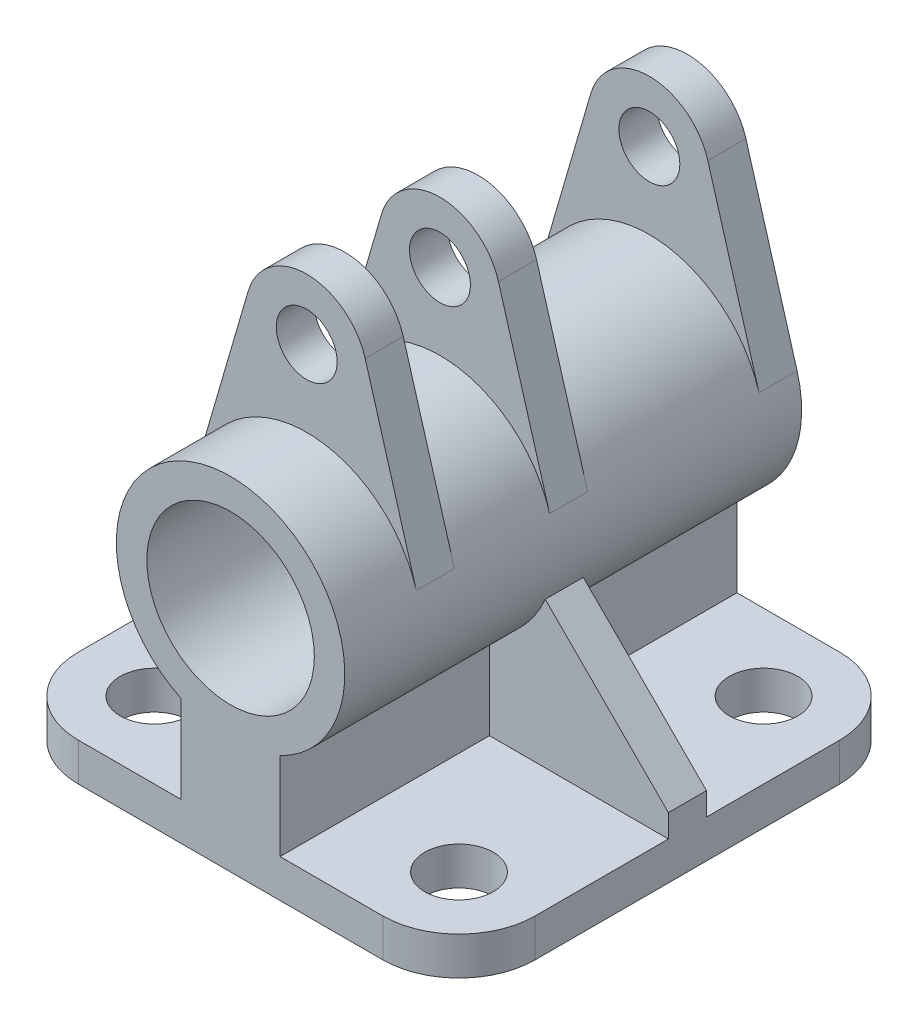
from build123d import *

# Parameters (mm, degrees)
SKETCH_1_R               = 15
SKETCH_1_R_2             = 11
EXTRUDE_1_DEPTH          = 30
SKETCH_1_3_R             = 4
EXTRUDE_2_DEPTH          = 2.5
EXTRUDE_START            = 20
SKETCH_1_6_R             = 4
EXTRUDE_3_DEPTH          = 5
EXTRUDE_START_2          = -25
SKETCH_1_7_R             = 4
EXTRUDE_4_DEPTH          = 5
SKETCH_2_R               = 4.5
CUT_EXTRUDE_1_DEPTH      = 72.860976893
MIRROR_2_COPY_1_SKETCH_R = 4.5
MIRROR_2_COPY_1_DEPTH    = 72.860976893
FILLET_1_R               = 10


with BuildPart() as part:
    # Эскиз1 → Бобышка-Вытянуть1 (new, symmetric)
    # profile 1 of 2: a face of its own
    with BuildSketch(Plane.XY):
        with BuildLine():
            Line((6.5, -25), (6.5, -13.518505835))
            ThreePointArc((6.5, -13.518505835), (0, -15), (-6.5, -13.518505835))
            Line((-6.5, -13.518505835), (-6.5, -25))
            Line((-6.5, -25), (-30, -25))
            Line((-30, -25), (-30, -30))
            Line((-30, -30), (30, -30))
            Line((30, -30), (30, -25))
            Line((30, -25), (6.5, -25))
        make_face()
    # profile 2 of 2: a face of its own
    with BuildSketch(Plane.XY):
        Circle(SKETCH_1_R)
        Circle(SKETCH_1_R_2, mode=Mode.SUBTRACT)
    extrude(amount=EXTRUDE_1_DEPTH, both=True)

    # Эскиз1<3> → Бобышка-Вытянуть2 (add, symmetric)
    # profile 1 of 3: a face of its own
    with BuildSketch(Plane.XY):
        with BuildLine():
            ThreePointArc((-14.4, 4.2), (0, 15), (14.4, 4.2))
            Line((14.4, 4.2), (7.68, 27.24))
            ThreePointArc((7.68, 27.24), (0, 33), (-7.68, 27.24))
            Line((-7.68, 27.24), (-14.4, 4.2))
        make_face()
        with Locations((0, 25)):
            Circle(SKETCH_1_3_R, mode=Mode.SUBTRACT)
    # profile 2 of 3: a face of its own
    with BuildSketch(Plane.XY):
        with BuildLine():
            Line((30, -22), (13.823441352, -5.823441352))
            ThreePointArc((13.823441352, -5.823441352), (10.865729218, -10.340982959), (6.5, -13.518505835))
            Line((6.5, -13.518505835), (6.5, -25))
            Line((6.5, -25), (30, -25))
            Line((30, -25), (30, -22))
        make_face()
    # profile 3 of 3: a face of its own
    with BuildSketch(Plane.XY):
        with BuildLine():
            Line((-6.5, -25), (-6.5, -13.518505835))
            ThreePointArc((-6.5, -13.518505835), (-10.865729218, -10.340982959), (-13.823441352, -5.823441352))
            Line((-13.823441352, -5.823441352), (-30, -22))
            Line((-30, -22), (-30, -25))
            Line((-30, -25), (-6.5, -25))
        make_face()
    extrude(amount=EXTRUDE_2_DEPTH, both=True)

    # Эскиз1<6> → Бобышка-Вытянуть3 (add)
    with BuildSketch(Plane.XY.offset(EXTRUDE_START)):
        with BuildLine():
            ThreePointArc((-14.4, 4.2), (0, 15), (14.4, 4.2))
            Line((14.4, 4.2), (7.68, 27.24))
            ThreePointArc((7.68, 27.24), (0, 33), (-7.68, 27.24))
            Line((-7.68, 27.24), (-14.4, 4.2))
        make_face()
        with Locations((0, 25)):
            Circle(SKETCH_1_6_R, mode=Mode.SUBTRACT)
    extrude(amount=-EXTRUDE_3_DEPTH)

    # Эскиз1<7> → Бобышка-Вытянуть4 (add)
    with BuildSketch(Plane.XY.offset(EXTRUDE_START_2)):
        with BuildLine():
            ThreePointArc((-14.4, 4.2), (0, 15), (14.4, 4.2))
            Line((14.4, 4.2), (7.68, 27.24))
            ThreePointArc((7.68, 27.24), (0, 33), (-7.68, 27.24))
            Line((-7.68, 27.24), (-14.4, 4.2))
        make_face()
        with Locations((0, 25)):
            Circle(SKETCH_1_7_R, mode=Mode.SUBTRACT)
    extrude(amount=-EXTRUDE_4_DEPTH)

    # Эскиз2 → Вырез-Вытянуть1 (cut, through all)
    with BuildSketch(Plane(origin=(0, -25, 0), x_dir=(1, 0, 0), z_dir=(0, 1, 0))):
        with Locations(Location((20, 20, 0), (0, 0, 180))):
            Circle(SKETCH_2_R)
    cut_extrude_1 = extrude(amount=-CUT_EXTRUDE_1_DEPTH, mode=Mode.SUBTRACT)

    # Зеркальное отражение1: Вырез-Вытянуть1 across plane
    add(cut_extrude_1.mirror(Plane.XY), mode=Mode.SUBTRACT)

    # Зеркальное отражение2: Вырез-Вытянуть1 across plane
    add(cut_extrude_1.mirror(Plane(origin=(0, 0, 0), x_dir=(0, 0, 1), z_dir=(1, 0, 0))), mode=Mode.SUBTRACT)

    # Зеркальное отражение2 copy 1 sketch → Зеркальное отражение2 copy 1 (cut, through all)
    with BuildSketch(Plane(origin=(0, -25, 0), x_dir=(-1, 0, 0), z_dir=(0, 1, 0))):
        with Locations(Location((20, 20, 0), (0, 0, 180))):
            Circle(MIRROR_2_COPY_1_SKETCH_R)
    extrude(amount=-MIRROR_2_COPY_1_DEPTH, mode=Mode.SUBTRACT)

    # Скругление1
    fillet_1_edges = [part.edges().sort_by_distance(p)[0] for p in [
        (30, -27.5, -30),
        (-30, -27.5, -30),
        (-30, -27.5, 30),
        (30, -27.5, 30),
    ]]
    fillet(fillet_1_edges, radius=FILLET_1_R)


solid = part.part
